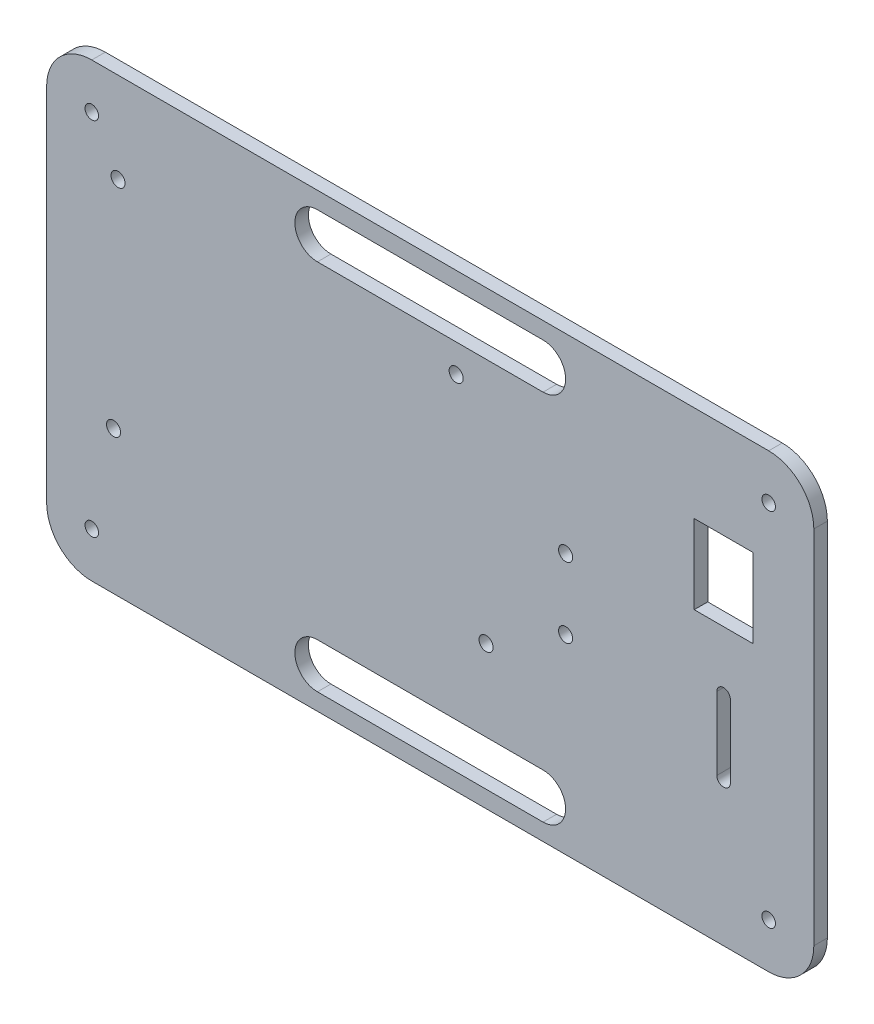
from build123d import *

# Parameters (mm, degrees)
SKETCH1_R           = 1.5
SKETCH1_R_2         = 1.56
SKETCH1_W           = 13
SKETCH1_H           = 17.5
BOSS_EXTRUDE1_DEPTH = 3


with BuildPart() as part:
    # Sketch1 → Boss-Extrude1 (new body)
    with BuildSketch(Plane.XY):
        with BuildLine():
            Line((-75, 50), (75, 50))
            ThreePointArc((75, 50), (82.071067812, 47.071067812), (85, 40))
            Line((85, 40), (85, -40))
            ThreePointArc((85, -40), (82.071067812, -47.071067812), (75, -50))
            Line((75, -50), (-75, -50))
            ThreePointArc((-75, -50), (-82.071067812, -47.071067812), (-85, -40))
            Line((-85, -40), (-85, 40))
            ThreePointArc((-85, 40), (-82.071067812, 47.071067812), (-75, 50))
        make_face()
        with Locations((-75, 40)):
            Circle(SKETCH1_R, mode=Mode.SUBTRACT)
        with Locations((-75, -40)):
            Circle(SKETCH1_R, mode=Mode.SUBTRACT)
        with Locations((75, -40)):
            Circle(SKETCH1_R, mode=Mode.SUBTRACT)
        with Locations((75, 40)):
            Circle(SKETCH1_R, mode=Mode.SUBTRACT)
        with Locations((-69.18, 30)):
            Circle(SKETCH1_R_2, mode=Mode.SUBTRACT)
        with Locations((5.75, 30)):
            Circle(SKETCH1_R_2, mode=Mode.SUBTRACT)
        with Locations((12.37, -18.3)):
            Circle(SKETCH1_R_2, mode=Mode.SUBTRACT)
        with Locations((-70.18, -18.3)):
            Circle(SKETCH1_R_2, mode=Mode.SUBTRACT)
        with Locations((30, 7.78)):
            Circle(SKETCH1_R_2, mode=Mode.SUBTRACT)
        with Locations((30, -7.78)):
            Circle(SKETCH1_R_2, mode=Mode.SUBTRACT)
        with BuildLine():
            Line((-25, 46.257829906), (25, 46.257829906))
            ThreePointArc((25, 46.257829906), (30, 41.257829906), (25, 36.257829906))
            Line((25, 36.257829906), (-25, 36.257829906))
            ThreePointArc((-25, 36.257829906), (-30, 41.257829906), (-25, 46.257829906))
        make_face(mode=Mode.SUBTRACT)
        with BuildLine():
            Line((-25, -46.257829906), (25, -46.257829906))
            ThreePointArc((25, -46.257829906), (30, -41.257829906), (25, -36.257829906))
            Line((25, -36.257829906), (-25, -36.257829906))
            ThreePointArc((-25, -36.257829906), (-30, -41.257829906), (-25, -46.257829906))
        make_face(mode=Mode.SUBTRACT)
        with Locations((65, 20)):
            Rectangle(SKETCH1_W, SKETCH1_H, mode=Mode.SUBTRACT)
        with BuildLine():
            Line((66.5, -1.95), (66.5, -18.05))
            ThreePointArc((66.5, -18.05), (65, -19.55), (63.5, -18.05))
            Line((63.5, -18.05), (63.5, -1.95))
            ThreePointArc((63.5, -1.95), (65, -0.45), (66.5, -1.95))
        make_face(mode=Mode.SUBTRACT)
    extrude(amount=BOSS_EXTRUDE1_DEPTH)


solid = part.part
